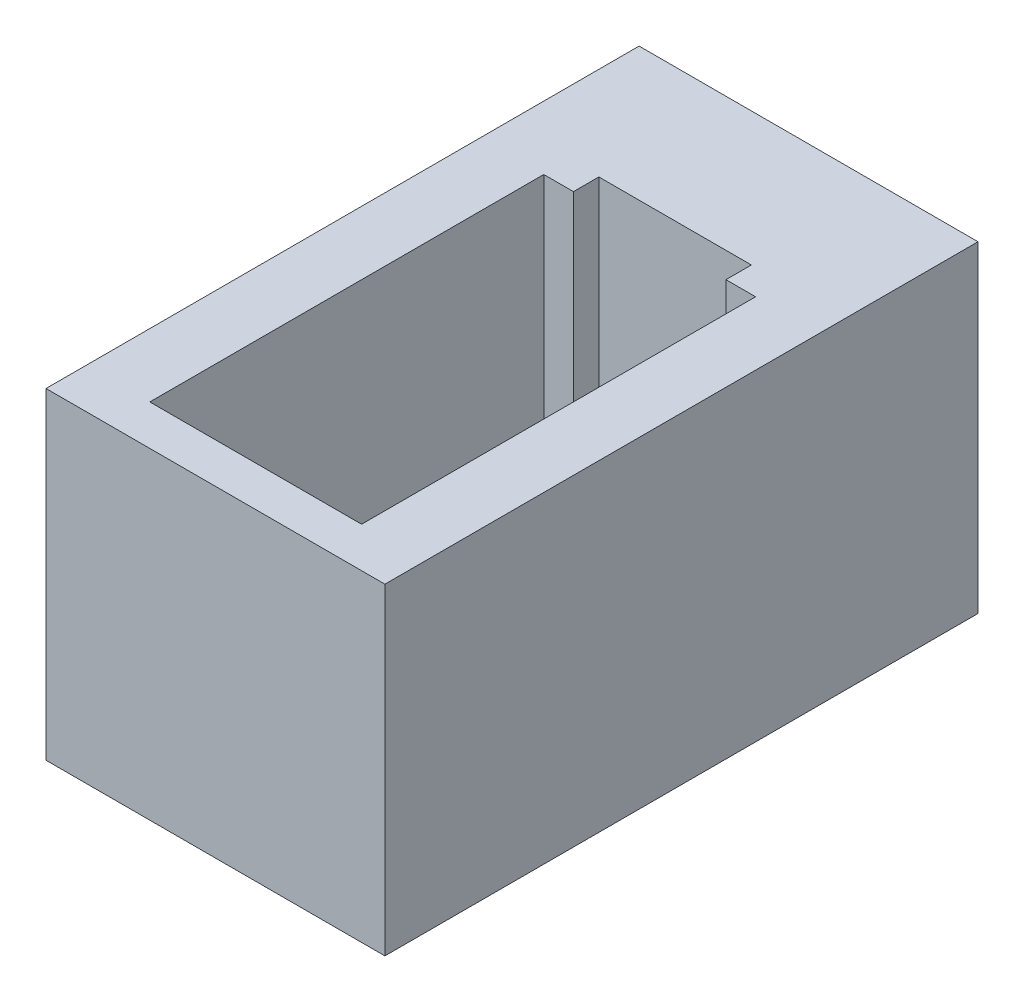
from build123d import *

# Parameters (mm, degrees)
SKETCH2_W           = 20
SKETCH2_H           = 28
BOSS_EXTRUDE1_DEPTH = 19
SKETCH3_W           = 12.5
SKETCH3_H           = 23.25
CUT_EXTRUDE1_DEPTH  = 16
SKETCH4_W           = 20
SKETCH4_H           = 19
BOSS_EXTRUDE3_DEPTH = 7
SKETCH5_W           = 9
SKETCH5_H           = 5
CUT_EXTRUDE2_DEPTH  = 31.033314835


with BuildPart() as part:
    # Sketch2 → Boss-Extrude1 (new body)
    with BuildSketch(Plane(origin=(0, 0, 0), x_dir=(1, 0, 0), z_dir=(0, 1, 0))):
        Rectangle(SKETCH2_W, SKETCH2_H)
    extrude(amount=BOSS_EXTRUDE1_DEPTH)

    # Sketch3 → Cut-Extrude1 (cut)
    with BuildSketch(Plane(origin=(0, 19, 0), x_dir=(1, 0, 0), z_dir=(0, 1, 0))):
        Rectangle(SKETCH3_W, SKETCH3_H)
    extrude(amount=-CUT_EXTRUDE1_DEPTH, mode=Mode.SUBTRACT)

    # Sketch4 → Boss-Extrude3 (add)
    with BuildSketch(Plane(origin=(0, 0, -14), x_dir=(-1, 0, 0), z_dir=(0, 0, -1))):
        with Locations((0, 9.5)):
            Rectangle(SKETCH4_W, SKETCH4_H)
    extrude(amount=BOSS_EXTRUDE3_DEPTH)

    # Sketch5 → Cut-Extrude2 (cut, through all)
    with BuildSketch(Plane.XZ):
        with Locations((0, -10.625)):
            Rectangle(SKETCH5_W, SKETCH5_H)
    extrude(amount=-CUT_EXTRUDE2_DEPTH, mode=Mode.SUBTRACT)


solid = part.part
